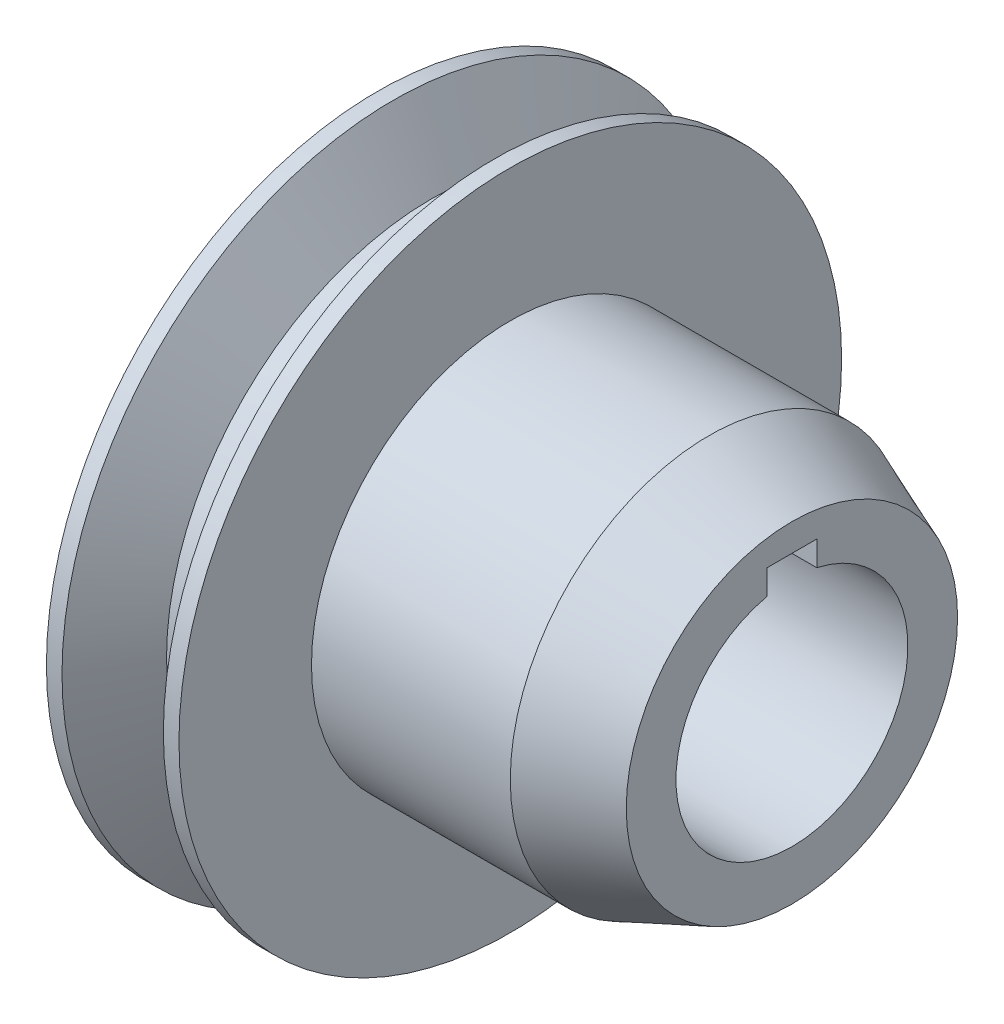
from build123d import *

# Parameters (mm, degrees)
CUT_EXTRUDE1_DEPTH = 38.749172176


with BuildPart() as part:
    # Sketch1 → Revolve1 (revolve)
    with BuildSketch(Plane.XY, mode=Mode.PRIVATE) as revolve1_sk:
        Polygon((0.75, 16), (-0.75, 16), (-3.059401077, 20), (-4, 20), (-4, 0), (4, 0), (21, 0), (21, 10), (16, 12), (4, 12), (4, 20), (3.059401077, 20), align=None)
    revolve(revolve1_sk.sketch.rotate(Axis((-19.792492436, 0, 0), (1, 0, 0)), 90), axis=Axis((-19.792492436, 0, 0), (1, 0, 0)))

    # Sketch2 → Cut-Extrude1 (cut, through all)
    with BuildSketch(Plane.ZY.offset(4)):
        with BuildLine():
            Line((-1.5, 8.337397166), (1.5, 8.337397166))
            Line((1.5, 8.337397166), (1.5, 6.837397166))
            ThreePointArc((1.5, 6.837397166), (0, -7), (-1.5, 6.837397166))
            Line((-1.5, 6.837397166), (-1.5, 8.337397166))
        make_face()
    extrude(amount=-CUT_EXTRUDE1_DEPTH, mode=Mode.SUBTRACT)


solid = part.part
